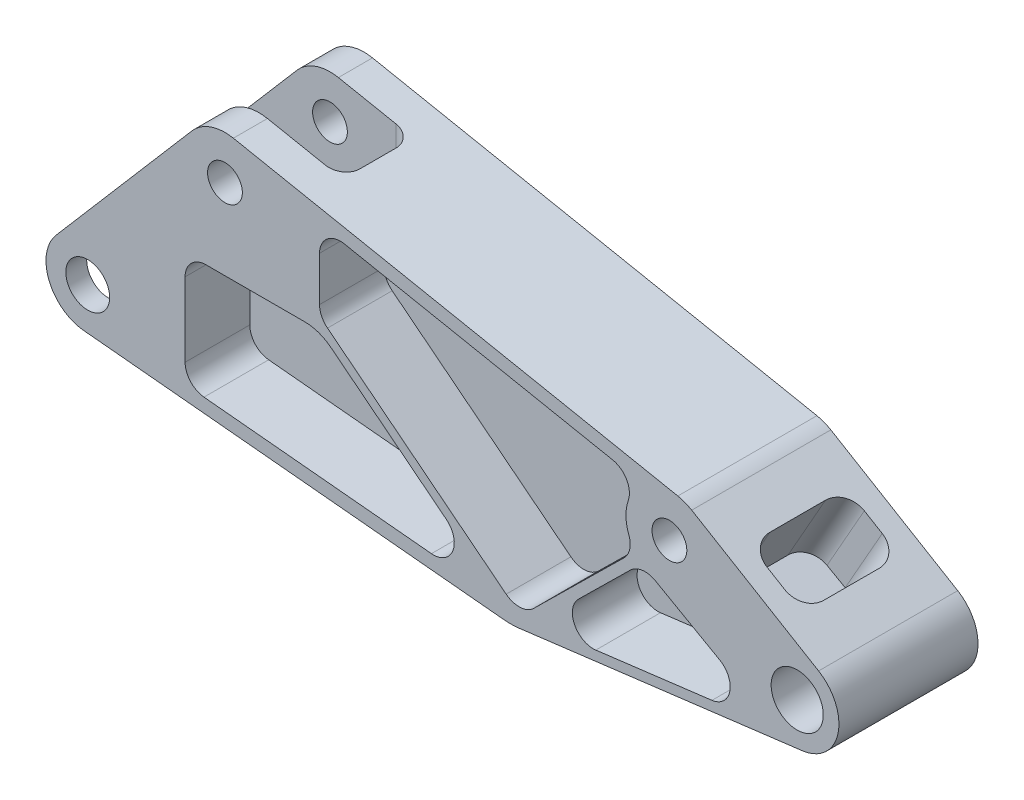
from build123d import *

# Parameters (mm, degrees)
SKETCH1_R           = 4.7625
SKETCH1_R_2         = 3.175
SKETCH1_R_3         = 4
BOSS_EXTRUDE1_DEPTH = 12.7
BOSS_EXTRUDE2_DEPTH = 0.889
SKETCH1_6_R         = 3.175
CUT_EXTRUDE1_DEPTH  = 6.477
SKETCH1_7_R         = 4
CUT_EXTRUDE2_DEPTH  = 8.89
CUT_EXTRUDE3_DEPTH  = 8.89
FILLET1_R           = 3.81
FILLET2_R           = 3.175
FILLET3_R           = 12.7


with BuildPart() as part:
    # Sketch1 → Boss-Extrude1 (new, symmetric)
    with BuildSketch(Plane(origin=(0, 0, 0), x_dir=(0, 1, 0), z_dir=(0, 0, 1))):
        with BuildLine():
            ThreePointArc((20.382390084, 19.257386231), (20.978466311, 20.483226967), (21.356021011, 21.792976878))
            Line((21.356021011, 21.792976878), (37.358021011, 102.945465221))
            ThreePointArc((37.358021011, 102.945465221), (37.070944625, 107.078516049), (34.740471159, 110.503923386))
            Line((34.740471159, 110.503923386), (5.831671261, 135.319049463))
            ThreePointArc((5.831671261, 135.319049463), (-1.978401206, 136.605306542), (-6.716685754, 130.264932046))
            Line((-6.716685754, 130.264932046), (-14.212594445, 52.146935376))
            Line((-14.212594445, 52.146935376), (-7.560895503, -0.947237667))
            ThreePointArc((-7.560895503, -0.947237667), (-1.565846257, -7.457380606), (6.54135972, -3.908326114))
            Line((6.54135972, -3.908326114), (20.382390084, 19.257386231))
        make_face()
        with BuildLine():
            Line((-7.837469994, 15.563413639), (-10.493663341, 36.765273562))
            ThreePointArc((-10.493663341, 36.765273562), (-8.373880181, 40.667929158), (-3.997617473, 39.911274641))
            Line((-3.997617473, 39.911274641), (5.30705743, 30.456131128))
            ThreePointArc((5.30705743, 30.456131128), (6.36872877, 28.282081545), (5.907210919, 25.907078618))
            Line((5.907210919, 25.907078618), (-0.741270636, 14.160362208))
            ThreePointArc((-0.741270636, 14.160362208), (-4.796024243, 12.29938936), (-7.837469994, 15.563413639))
        make_face(mode=Mode.SUBTRACT)
        Circle(SKETCH1_R, mode=Mode.SUBTRACT)
        with BuildLine():
            Line((-9.835366262, 53.132289554), (15.923267524, 85.759892349))
            ThreePointArc((15.923267524, 85.759892349), (17.252153249, 86.827671128), (18.91367086, 87.20904761))
            Line((18.91367086, 87.20904761), (27.031501436, 87.20904761))
            ThreePointArc((27.031501436, 87.20904761), (29.974660714, 85.818533808), (30.769524141, 82.661968063))
            Line((30.769524141, 82.661968063), (21.115821085, 33.704211238))
            ThreePointArc((21.115821085, 33.704211238), (19.280612759, 31.140473092), (16.14234173, 30.837161644))
            ThreePointArc((16.14234173, 30.837161644), (13.427097985, 31.264800137), (10.728808005, 30.740725275))
            ThreePointArc((10.728808005, 30.740725275), (8.557460112, 30.575295213), (6.65017035, 31.626182714))
            Line((6.65017035, 31.626182714), (-9.560561043, 48.099062569))
            ThreePointArc((-9.560561043, 48.099062569), (-10.649296851, 50.563734965), (-9.835366262, 53.132289554))
        make_face(mode=Mode.SUBTRACT)
        with Locations((13.568473709, 23.328559267)):
            Circle(SKETCH1_R_2, mode=Mode.SUBTRACT)
        with BuildLine():
            ThreePointArc((-6.271634521, 108.311010382), (-5.041237302, 110.766897358), (-2.479054789, 111.757088718))
            Line((-2.479054789, 111.757088718), (11.028473709, 111.757088718))
            ThreePointArc((11.028473709, 111.757088718), (13.722550546, 110.641165554), (14.838473709, 107.947088718))
            Line((14.838473709, 107.947088718), (14.838473709, 89.9005863))
            ThreePointArc((14.838473709, 89.9005863), (14.417020328, 87.40152116), (13.199280383, 85.178896821))
            Line((13.199280383, 85.178896821), (-3.47332856, 64.060258828))
            ThreePointArc((-3.47332856, 64.060258828), (-7.883928971, 62.885691248), (-10.256311628, 66.785025232))
            Line((-10.256311628, 66.785025232), (-6.271634521, 108.311010382))
        make_face(mode=Mode.SUBTRACT)
        with Locations((0.868473709, 129.537088718)):
            Circle(SKETCH1_R_3, mode=Mode.SUBTRACT)
        with Locations((29.570473709, 104.48104761)):
            Circle(SKETCH1_R_2, mode=Mode.SUBTRACT)
    extrude(amount=BOSS_EXTRUDE1_DEPTH, both=True)

    # Sketch1<5> → Boss-Extrude2 (add, symmetric)
    with BuildSketch(Plane(origin=(0, 0, 0), x_dir=(0, 1, 0), z_dir=(0, 0, 1))):
        with BuildLine():
            Line((11.028473709, 111.757088718), (-2.479054789, 111.757088718))
            ThreePointArc((-2.479054789, 111.757088718), (-5.041237302, 110.766897358), (-6.271634521, 108.311010382))
            Line((-6.271634521, 108.311010382), (-10.256311628, 66.785025232))
            ThreePointArc((-10.256311628, 66.785025232), (-7.883928971, 62.885691248), (-3.47332856, 64.060258828))
            Line((-3.47332856, 64.060258828), (13.199280383, 85.178896821))
            ThreePointArc((13.199280383, 85.178896821), (14.417020328, 87.40152116), (14.838473709, 89.9005863))
            Line((14.838473709, 89.9005863), (14.838473709, 107.947088718))
            ThreePointArc((14.838473709, 107.947088718), (13.722550546, 110.641165554), (11.028473709, 111.757088718))
        make_face()
        with BuildLine():
            ThreePointArc((18.91367086, 87.20904761), (17.252153249, 86.827671128), (15.923267524, 85.759892349))
            Line((15.923267524, 85.759892349), (-9.835366262, 53.132289554))
            ThreePointArc((-9.835366262, 53.132289554), (-10.649296851, 50.563734965), (-9.560561043, 48.099062569))
            Line((-9.560561043, 48.099062569), (6.65017035, 31.626182714))
            ThreePointArc((6.65017035, 31.626182714), (8.557460112, 30.575295213), (10.728808005, 30.740725275))
            ThreePointArc((10.728808005, 30.740725275), (13.427097985, 31.264800137), (16.14234173, 30.837161644))
            ThreePointArc((16.14234173, 30.837161644), (19.280612759, 31.140473092), (21.115821085, 33.704211238))
            Line((21.115821085, 33.704211238), (30.769524141, 82.661968063))
            ThreePointArc((30.769524141, 82.661968063), (29.974660714, 85.818533808), (27.031501436, 87.20904761))
            Line((27.031501436, 87.20904761), (18.91367086, 87.20904761))
        make_face()
        with BuildLine():
            ThreePointArc((-3.997617473, 39.911274641), (-8.373880181, 40.667929158), (-10.493663341, 36.765273562))
            Line((-10.493663341, 36.765273562), (-7.837469994, 15.563413639))
            ThreePointArc((-7.837469994, 15.563413639), (-4.796024243, 12.29938936), (-0.741270636, 14.160362208))
            Line((-0.741270636, 14.160362208), (5.907210919, 25.907078618))
            ThreePointArc((5.907210919, 25.907078618), (6.36872877, 28.282081545), (5.30705743, 30.456131128))
            Line((5.30705743, 30.456131128), (-3.997617473, 39.911274641))
        make_face()
    extrude(amount=BOSS_EXTRUDE2_DEPTH, both=True)

    # Sketch1<6> → Cut-Extrude1 (cut, symmetric)
    with BuildSketch(Plane(origin=(0, 0, 0), x_dir=(0, 1, 0), z_dir=(0, 0, 1))):
        with BuildLine():
            Line((16.870473709, 89.24104761), (34.655724444, 89.24104761))
            Line((34.655724444, 89.24104761), (37.358021011, 102.945465221))
            ThreePointArc((37.358021011, 102.945465221), (37.070944625, 107.078516049), (34.740471159, 110.503923386))
            Line((34.740471159, 110.503923386), (16.870473709, 125.843413136))
            Line((16.870473709, 125.843413136), (16.870473709, 89.24104761))
        make_face()
        with Locations((29.570473709, 104.48104761)):
            Circle(SKETCH1_6_R, mode=Mode.SUBTRACT)
    extrude(amount=CUT_EXTRUDE1_DEPTH, both=True, mode=Mode.SUBTRACT)

    # Sketch1<7> → Cut-Extrude2 (cut, symmetric)
    with BuildSketch(Plane(origin=(0, 0, 0), x_dir=(0, 1, 0), z_dir=(0, 0, 1))):
        with BuildLine():
            Line((14.838473709, 114.297088718), (14.838473709, 127.587668738))
            Line((14.838473709, 127.587668738), (5.831671261, 135.319049463))
            ThreePointArc((5.831671261, 135.319049463), (-1.978401206, 136.605306542), (-6.716685754, 130.264932046))
            Line((-6.716685754, 130.264932046), (-8.248899849, 114.297088718))
            Line((-8.248899849, 114.297088718), (14.838473709, 114.297088718))
        make_face()
        with Locations((0.868473709, 129.537088718)):
            Circle(SKETCH1_7_R, mode=Mode.SUBTRACT)
    extrude(amount=CUT_EXTRUDE2_DEPTH, both=True, mode=Mode.SUBTRACT)

    # Sketch1<9> → Cut-Extrude3 (cut, symmetric)
    with BuildSketch(Plane(origin=(0, 0, 0), x_dir=(0, 1, 0), z_dir=(0, 0, 1))):
        Polygon((10.542747735, 2.788791174), (16.405901968, 12.601943868), (4.298278893, 19.454693681), (-1.330811933, 9.509064286), align=None)
    extrude(amount=CUT_EXTRUDE3_DEPTH, both=True, mode=Mode.SUBTRACT)

    # Fillet1
    fillet1_edges = [part.edges().sort_by_distance(p)[0] for p in [
        (-120.942378728, 14.838473709, 8.89),
        (-120.942378728, 14.838473709, -8.89),
        (-107.542230373, 16.870473709, 6.477),
        (-107.542230373, 16.870473709, -6.477),
        (-6.14892773, 4.605967901, -8.89),
        (-16.028318774, 10.352090431, -8.89),
        (-16.028318774, 10.352090431, 8.89),
        (-6.14892773, 4.605967901, 8.89),
    ]]
    fillet(fillet1_edges, radius=FILLET1_R)

    # Fillet2
    fillet2_edges = [part.edges().sort_by_distance(p)[0] for p in [
        (-89.24104761, 27.668099077, -6.477),
        (-89.24104761, 17.986396873, -5.361076836),
        (-89.24104761, 27.668099077, 6.477),
        (-89.24104761, 17.986396873, 5.361076836),
        (-89.24104761, 16.870473709, 0),
        (-114.297088718, 1.38978693, -8.89),
        (-114.297088718, 13.722550546, -7.774076836),
        (-114.297088718, 1.38978693, 8.89),
        (-114.297088718, 13.722550546, 7.774076836),
        (-114.297088718, 14.838473709, 0),
    ]]
    fillet(fillet2_edges, radius=FILLET2_R)

    # Fillet3
    fillet3_edges = [part.edges().sort_by_distance(p)[0] for p in [
        (-52.146935376, -14.212594445, 0),
    ]]
    fillet(fillet3_edges, radius=FILLET3_R)


solid = part.part
